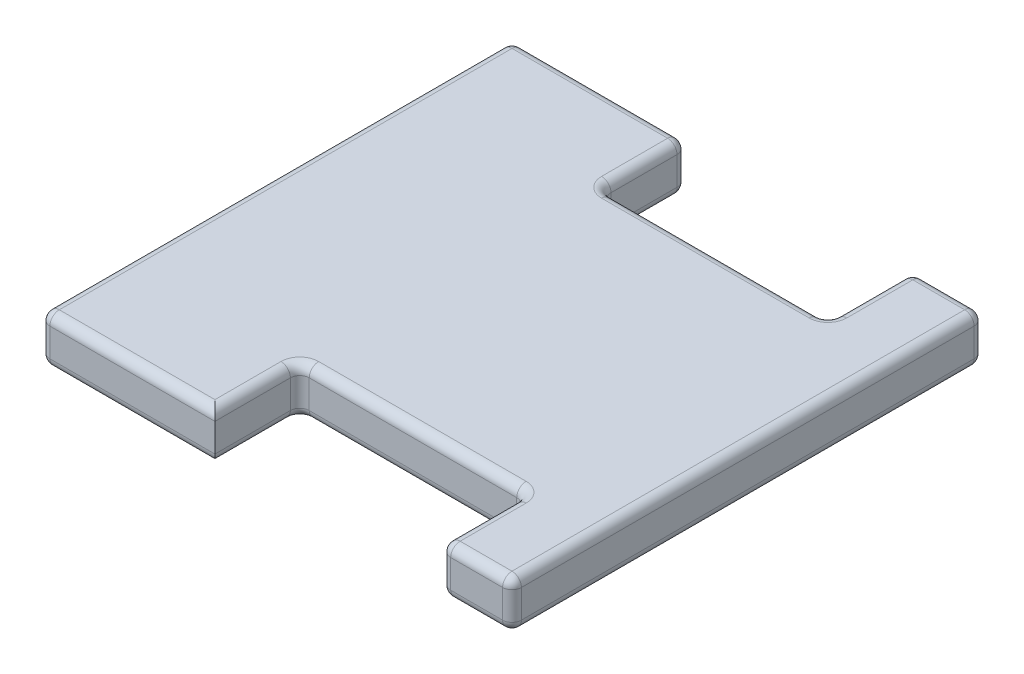
from build123d import *

# Parameters (mm, degrees)
BOSS_EXTRUDE1_DEPTH = 10
FILLET1_R           = 2


with BuildPart() as part:
    # Sketch1 → Boss-Extrude1 (new body)
    with BuildSketch(Plane(origin=(0, 0, 0), x_dir=(1, 0, 0), z_dir=(0, 1, 0))):
        Polygon((100, -50), (100, 50), (85, 50), (85, 32), (37, 32), (37, 50), (0, 50), (0, -50), (37, -50), (37, -32), (85, -32), (85, -50), align=None)
    extrude(amount=BOSS_EXTRUDE1_DEPTH)

    # Fillet1
    fillet1_edges = [part.edges().sort_by_distance(p)[0] for p in [
        (61, 0, 32),
        (37, 0, 41),
        (100, 10, 0),
        (18.5, 0, 50),
        (0, 0, 0),
        (18.5, 0, -50),
        (37, 0, -41),
        (61, 0, -32),
        (85, 0, -41),
        (92.5, 0, -50),
        (100, 0, 0),
        (92.5, 0, 50),
        (85, 0, 41),
        (92.5, 10, -50),
        (85, 5, 32),
        (37, 5, 32),
        (85, 10, -41),
        (0, 5, 50),
        (0, 5, -50),
        (37, 5, -50),
        (37, 5, -32),
        (85, 5, -32),
        (85, 5, -50),
        (100, 5, -50),
        (100, 5, 50),
        (85, 5, 50),
        (61, 10, -32),
        (37, 10, -41),
        (18.5, 10, -50),
        (0, 10, 0),
        (18.5, 10, 50),
        (37, 10, 41),
        (61, 10, 32),
        (85, 10, 41),
        (92.5, 10, 50),
    ]]
    fillet(fillet1_edges, radius=FILLET1_R)


solid = part.part
